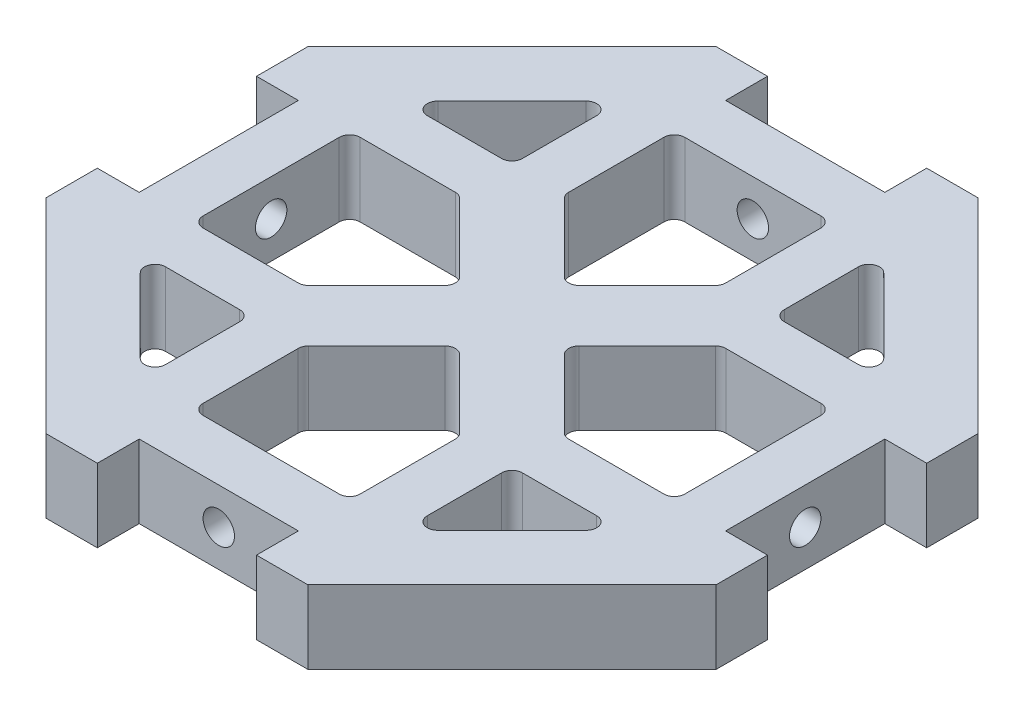
from build123d import *

# Parameters (mm, degrees)
EXTRUDE_1_DEPTH          = 7
CUT_EXTRUDE_1_DEPTH      = 69.359344643
CUT_EXTRUDE_1_DEPTH_BACK = 69.359344643
SKETCH_2_R               = 1.5
SKETCH_3_R               = 1.5
CUT_EXTRUDE_2_DEPTH      = 69.359344643
SKETCH_4_W               = 5
SKETCH_4_H               = 10.5
SKETCH_4_W_2             = 10.5
SKETCH_4_H_2             = 5
EXTRUDE_2_DEPTH          = 7
FILLET_1_R               = 1


with BuildPart() as part:
    # 草图1 → 凸台-拉伸1 (new body)
    with BuildSketch(Plane(origin=(0, 0, 0), x_dir=(1, 0, 0), z_dir=(0, 1, 0))):
        Polygon((-7.6, 28), (-7.6, 32), (-12.5, 32), (-32, 12.5), (-32, 7.6), (-28, 7.6), (-28, -7.6), (-32, -7.6), (-32, -12.5), (-12.5, -32), (-7.6, -32), (-7.6, -28), (7.6, -28), (7.6, -32), (12.5, -32), (32, -12.5), (32, -7.6), (28, -7.6), (28, 7.6), (32, 7.6), (32, 12.5), (12.5, 32), (7.6, 32), (7.6, 28), align=None)
        Polygon((-12.5, 23), (0, 23), (12.5, 23), (23, 12.5), (23, 0), (23, -12.5), (12.5, -23), (0, -23), (-12.5, -23), (-23, -12.5), (-23, 0), (-23, 12.5), align=None, mode=Mode.SUBTRACT)
    extrude(amount=EXTRUDE_1_DEPTH)

    # 草图2 → 切除-拉伸1 (cut, two sides: drawn at the far end of the back side and taken through both)
    with BuildSketch(Plane(origin=(0, 0, -28), x_dir=(-1, 0, 0), z_dir=(0, 0, -1)).offset(-CUT_EXTRUDE_1_DEPTH_BACK)):
        with Locations((0, 3.5)):
            Circle(SKETCH_2_R)
    extrude(amount=CUT_EXTRUDE_1_DEPTH + CUT_EXTRUDE_1_DEPTH_BACK, mode=Mode.SUBTRACT)

    # 草图3 → 切除-拉伸2 (cut, through all)
    with BuildSketch(Plane.ZY.offset(28)):
        with Locations((0, 3.5)):
            Circle(SKETCH_3_R)
    extrude(amount=-CUT_EXTRUDE_2_DEPTH, mode=Mode.SUBTRACT)

    # 草图4 → 凸台-拉伸2 (add)
    with BuildSketch(Plane(origin=(0, 7, 0), x_dir=(1, 0, 0), z_dir=(0, 1, 0))):
        with Locations((-10, 17.75)):
            Rectangle(SKETCH_4_W, SKETCH_4_H)
        Polygon((-12.5, 12.5), (-12.5, 7.5), (-7.5, 12.5), align=None)
        with Locations((-17.75, 10)):
            Rectangle(SKETCH_4_W_2, SKETCH_4_H_2)
        Polygon((-7.5, 12.5), (-12.5, 7.5), (-7.5, 7.5), align=None)
        Polygon((-7.5, 12.5), (-7.5, 7.5), (-2.5, 7.5), align=None)
        Polygon((-2.5, 7.5), (-7.5, 7.5), (-7.5, 2.5), (-5, 0), (0, 5), align=None)
        Polygon((-7.5, 7.5), (-12.5, 7.5), (-7.5, 2.5), align=None)
        Polygon((0, 5), (-5, 0), (0, -5), (5, 0), align=None)
        Polygon((5, 0), (0, -5), (2.5, -7.5), (7.5, -7.5), (7.5, -2.5), align=None)
        Polygon((7.5, -2.5), (7.5, -7.5), (12.5, -7.5), align=None)
        Polygon((7.5, -7.5), (7.5, -12.5), (12.5, -7.5), align=None)
        Polygon((2.5, -7.5), (7.5, -12.5), (7.5, -7.5), align=None)
        Polygon((12.5, -7.5), (7.5, -12.5), (12.5, -12.5), align=None)
        with Locations((17.75, -10)):
            Rectangle(SKETCH_4_W_2, SKETCH_4_H_2)
        with Locations((10, -17.75)):
            Rectangle(SKETCH_4_W, SKETCH_4_H)
        Polygon((12.5, 12.5), (7.5, 12.5), (12.5, 7.5), align=None)
        with Locations((10, 17.75)):
            Rectangle(SKETCH_4_W, SKETCH_4_H)
        with Locations((17.75, 10)):
            Rectangle(SKETCH_4_W_2, SKETCH_4_H_2)
        Polygon((12.5, 7.5), (7.5, 12.5), (7.5, 7.5), align=None)
        Polygon((12.5, 7.5), (7.5, 7.5), (7.5, 2.5), align=None)
        Polygon((7.5, 7.5), (7.5, 12.5), (2.5, 7.5), align=None)
        Polygon((7.5, 7.5), (2.5, 7.5), (0, 5), (5, 0), (7.5, 2.5), align=None)
        Polygon((-7.5, -2.5), (-7.5, -7.5), (-2.5, -7.5), (0, -5), (-5, 0), align=None)
        Polygon((-7.5, -2.5), (-12.5, -7.5), (-7.5, -7.5), align=None)
        Polygon((-2.5, -7.5), (-7.5, -7.5), (-7.5, -12.5), align=None)
        Polygon((-7.5, -7.5), (-12.5, -7.5), (-7.5, -12.5), align=None)
        Polygon((-7.5, -12.5), (-12.5, -7.5), (-12.5, -12.5), align=None)
        with Locations((-17.75, -10)):
            Rectangle(SKETCH_4_W_2, SKETCH_4_H_2)
        with Locations((-10, -17.75)):
            Rectangle(SKETCH_4_W, SKETCH_4_H)
    extrude(amount=-EXTRUDE_2_DEPTH)

    # 圆角1
    fillet_1_edges = [part.edges().sort_by_distance(p)[0] for p in [
        (7.5, 3.5, 12.5),
        (0, 3.5, 5),
        (-7.5, 3.5, 12.5),
        (-7.5, 3.5, 23),
        (-12.5, 3.5, 12.5),
        (-23, 3.5, 7.5),
        (-12.5, 3.5, 7.5),
        (-5, 3.5, 0),
        (-12.5, 3.5, -7.5),
        (-23, 3.5, -7.5),
        (-12.5, 3.5, -12.5),
        (-7.5, 3.5, -23),
        (-7.5, 3.5, -12.5),
        (0, 3.5, -5),
        (7.5, 3.5, -12.5),
        (7.5, 3.5, -23),
        (12.5, 3.5, -12.5),
        (23, 3.5, -7.5),
        (12.5, 3.5, -7.5),
        (5, 3.5, 0),
        (12.5, 3.5, 7.5),
        (23, 3.5, 7.5),
        (12.5, 3.5, 12.5),
        (7.5, 3.5, 23),
        (12.5, 3.5, 23),
        (23, 3.5, 12.5),
        (23, 3.5, -12.5),
        (12.5, 3.5, -23),
        (-12.5, 3.5, -23),
        (-23, 3.5, -12.5),
        (-23, 3.5, 12.5),
        (-12.5, 3.5, 23),
    ]]
    fillet(fillet_1_edges, radius=FILLET_1_R)


solid = part.part
